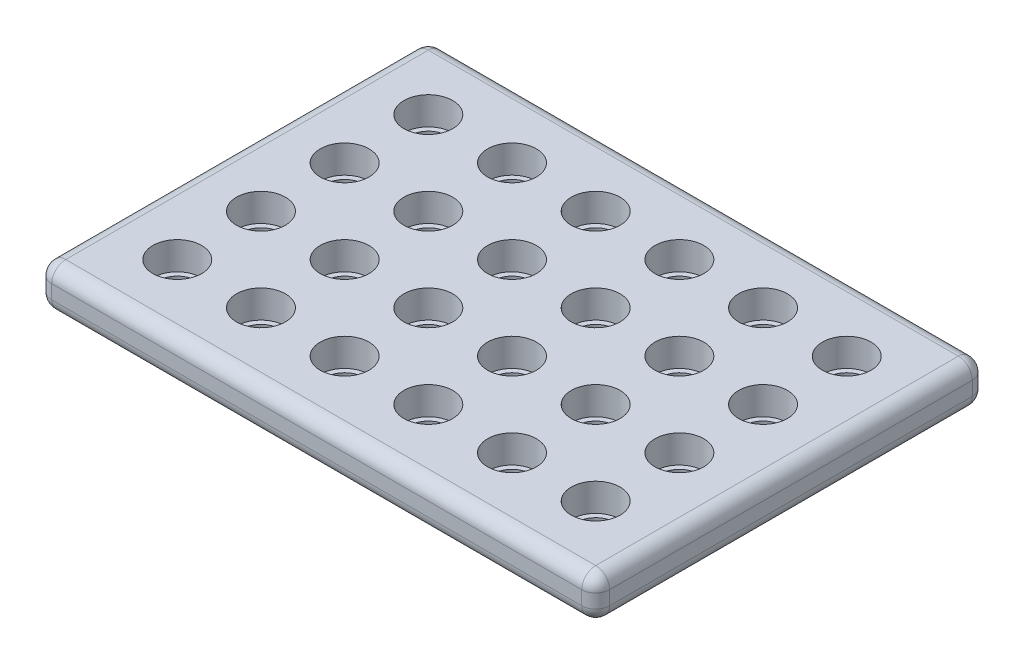
from build123d import *

# Parameters (mm, degrees)
SKETCH2_W            = 80
SKETCH2_H            = 56
BOSS_EXTRUDE1_DEPTH  = 6
SKETCH3_R            = 3.5
CUT_EXTRUDE1_DEPTH   = 4
SKETCH4_R            = 2.75
CUT_EXTRUDE2_DEPTH   = 98.836598469
LPATTERN1_COUNT      = 6
LPATTERN1_PITCH      = 12
LPATTERN1_COUNT_DIR2 = 4
LPATTERN1_PITCH_DIR2 = 12
FILLET1_R            = 2


with BuildPart() as part:
    # Sketch2 → Boss-Extrude1 (new body)
    with BuildSketch(Plane(origin=(0, 0, 0), x_dir=(1, 0, 0), z_dir=(0, 1, 0))):
        with Locations((40, 28)):
            Rectangle(SKETCH2_W, SKETCH2_H)
    extrude(amount=BOSS_EXTRUDE1_DEPTH)

    # Sketch3 → Cut-Extrude1 (cut)
    with BuildSketch(Plane(origin=(0, 6, 0), x_dir=(1, 0, 0), z_dir=(0, 1, 0))):
        with Locations(Location((10, 46, 0), (0, 0, 270))):
            Circle(SKETCH3_R)
    cut_extrude1 = extrude(amount=-CUT_EXTRUDE1_DEPTH, mode=Mode.SUBTRACT)

    # Sketch4 → Cut-Extrude2 (cut, through all)
    with BuildSketch(Plane(origin=(0, 6, 0), x_dir=(1, 0, 0), z_dir=(0, 1, 0))):
        with Locations(Location((10, 46, 0), (0, 0, 270))):
            Circle(SKETCH4_R)
    cut_extrude2 = extrude(amount=-CUT_EXTRUDE2_DEPTH, mode=Mode.SUBTRACT)

    # LPattern1: Cut-Extrude1, Cut-Extrude2 6 × 4
    with Locations(*[(i * LPATTERN1_PITCH, 0, j * LPATTERN1_PITCH_DIR2) for i in range(LPATTERN1_COUNT) for j in range(LPATTERN1_COUNT_DIR2) if (i, j) != (0, 0)]):
        add(cut_extrude1, mode=Mode.SUBTRACT)
        add(cut_extrude2, mode=Mode.SUBTRACT)

    # Fillet1
    fillet1_edges = [part.edges().sort_by_distance(p)[0] for p in [
        (80, 6, -28),
        (40, 6, -56),
        (0, 6, -28),
        (40, 0, -56),
        (80, 0, -28),
        (40, 0, 0),
        (0, 0, -28),
        (0, 3, -56),
        (80, 3, -56),
        (80, 3, 0),
        (0, 3, 0),
        (40, 6, 0),
    ]]
    fillet(fillet1_edges, radius=FILLET1_R)


solid = part.part
